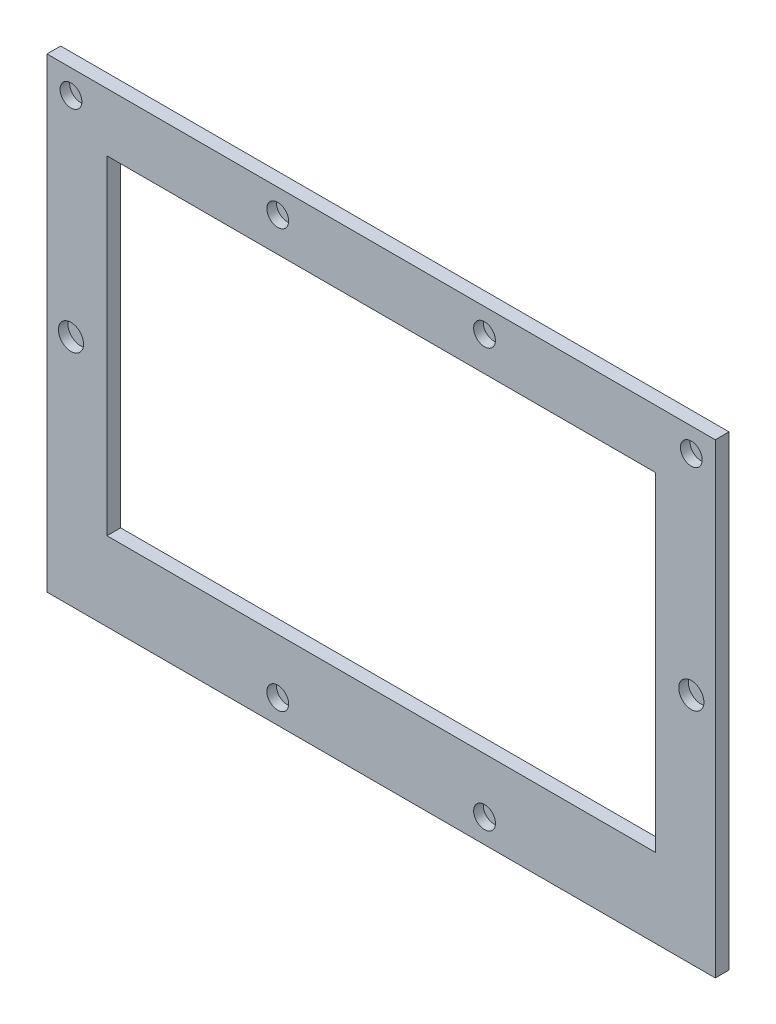
from build123d import *

# Parameters (mm, degrees)
SKETCH1_W           = 195
SKETCH1_H           = 136
SKETCH1_W_2         = 160
SKETCH1_H_2         = 96
BOSS_EXTRUDE1_DEPTH = 2
SKETCH1_3_W         = 195
SKETCH1_3_H         = 136
SKETCH1_3_W_2       = 160
SKETCH1_3_H_2       = 96
BOSS_EXTRUDE2_DEPTH = 2
SKETCH2_R           = 3.175
SKETCH2_R_2         = 3.673722566
CUT_EXTRUDE1_DEPTH  = 2.794


with BuildPart() as part:
    # Sketch1 → Boss-Extrude1 (new body)
    with BuildSketch(Plane.XY):
        Rectangle(SKETCH1_W, SKETCH1_H)
        with Locations((0, 3)):
            Rectangle(SKETCH1_W_2, SKETCH1_H_2, mode=Mode.SUBTRACT)
    extrude(amount=-BOSS_EXTRUDE1_DEPTH)

    # Sketch1<3> → Boss-Extrude2 (add)
    with BuildSketch(Plane.XY):
        Rectangle(SKETCH1_3_W, SKETCH1_3_H)
        with Locations((0, 3)):
            Rectangle(SKETCH1_3_W_2, SKETCH1_3_H_2, mode=Mode.SUBTRACT)
    extrude(amount=BOSS_EXTRUDE2_DEPTH)

    # Sketch2 → Cut-Extrude1 (cut)
    with BuildSketch(Plane.XY.offset(2)):
        with Locations((-90.5, 61)):
            Circle(SKETCH2_R)
        with Locations((90.5, 61)):
            Circle(SKETCH2_R)
        with Locations((-30.166666667, -61)):
            Circle(SKETCH2_R)
        with Locations((30.166666667, -61)):
            Circle(SKETCH2_R)
        with Locations((90.5, 0)):
            Circle(SKETCH2_R_2)
        with Locations((-30.166666667, 61)):
            Circle(SKETCH2_R)
        with Locations((30.166666667, 61)):
            Circle(SKETCH2_R)
        with Locations((-90.5, 0)):
            Circle(SKETCH2_R_2)
    extrude(amount=-CUT_EXTRUDE1_DEPTH, mode=Mode.SUBTRACT)


solid = part.part
